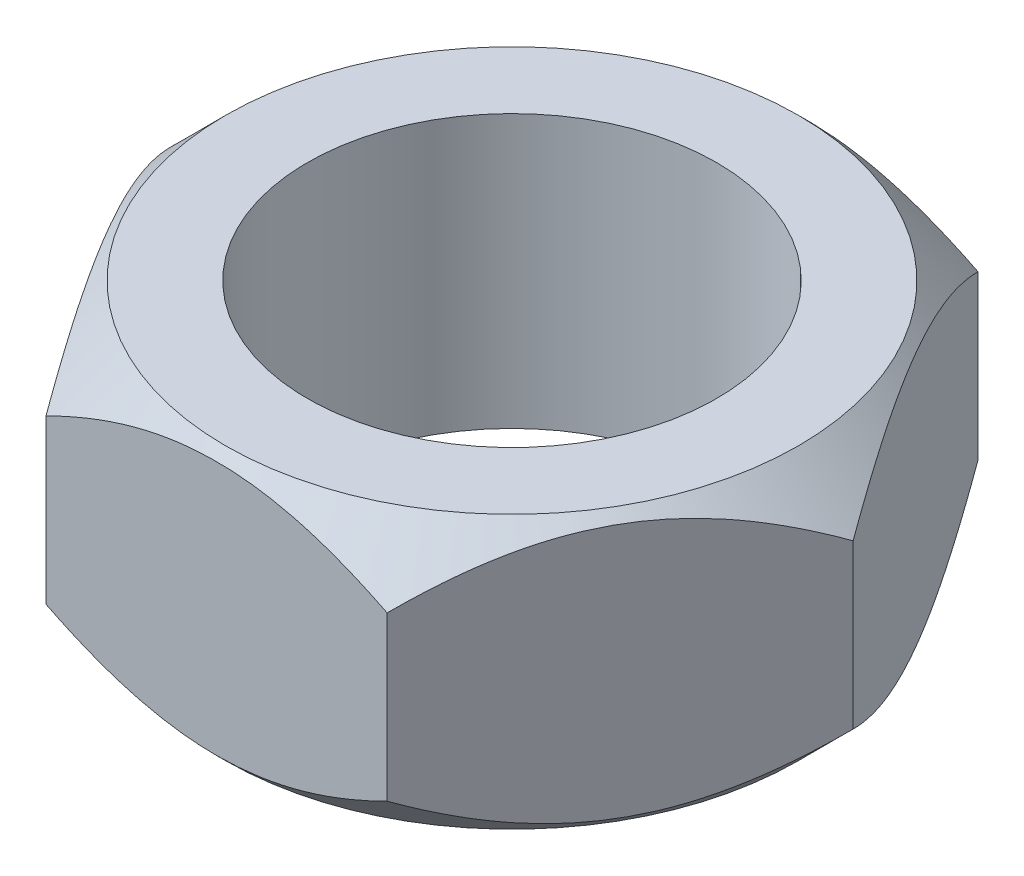
from build123d import *

# Parameters (mm, degrees)
SKETCH1_R           = 5.715
BOSS_EXTRUDE1_DEPTH = 7.62


with BuildPart() as part:
    # Sketch1 → Boss-Extrude1 (new body)
    with BuildSketch(Plane(origin=(0, 0, 0), x_dir=(1, 0, 0), z_dir=(0, 1, 0))):
        Polygon((-4.766026472, 8.255), (-9.532052944, 0), (-4.766026472, -8.255), (4.766026472, -8.255), (9.532052944, 0), (4.766026472, 8.255), align=None)
        with Locations(Location((0, 0, 0), (0, 0, 90))):
            Circle(SKETCH1_R, mode=Mode.SUBTRACT)
    extrude(amount=BOSS_EXTRUDE1_DEPTH)

    # Sketch2 → Cut-Revolve1 (revolve, cut)
    with BuildSketch(Plane(origin=(0, 0, 0), x_dir=(0, 0, -1), z_dir=(1, 0, 0)), mode=Mode.PRIVATE) as cut_revolve1_sk:
        Polygon((-8.001, 7.62), (-11.811, 3.81), (-8.001, 0), (-14.351, 0), (-14.351, 7.62), align=None)
    revolve(cut_revolve1_sk.sketch.rotate(Axis((0, 7.62, 0), (0, -1, 0)), 210.000000045), axis=Axis((0, 7.62, 0), (0, -1, 0)), mode=Mode.SUBTRACT)


solid = part.part
